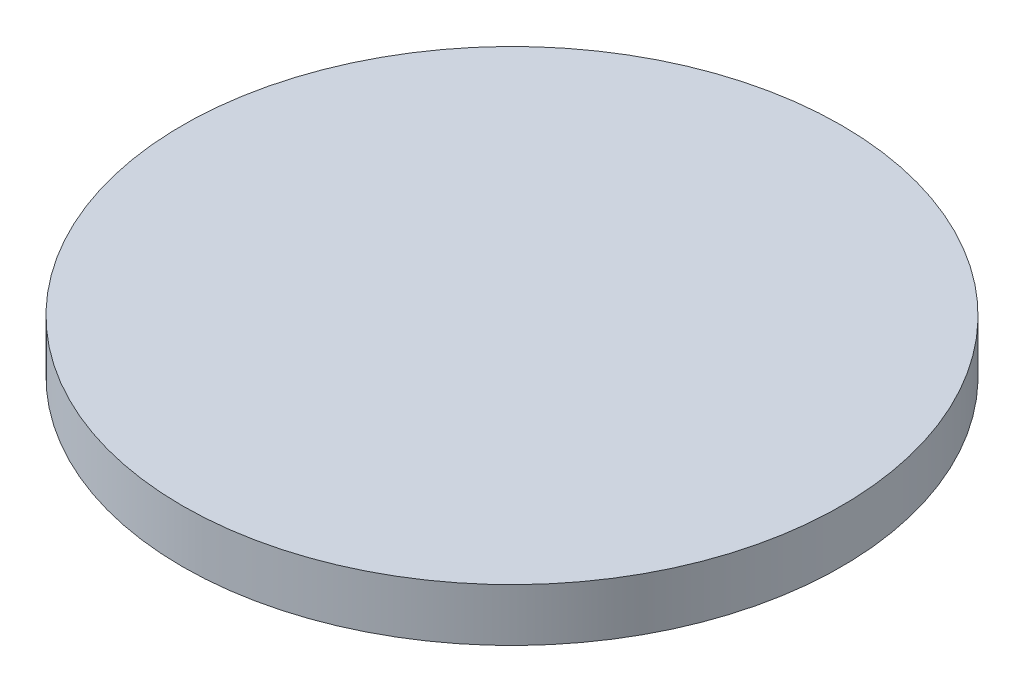
from build123d import *

# Parameters (mm, degrees)
SKETCH1_R           = 10
BOSS_EXTRUDE1_DEPTH = 1.6


with BuildPart() as part:
    # Sketch1 → Boss-Extrude1 (new body)
    with BuildSketch(Plane(origin=(0, 0, 0), x_dir=(1, 0, 0), z_dir=(0, 1, 0))):
        with Locations(Location((0, 0, 0), (0, 0, 270))):
            Circle(SKETCH1_R)
    extrude(amount=BOSS_EXTRUDE1_DEPTH)


solid = part.part
